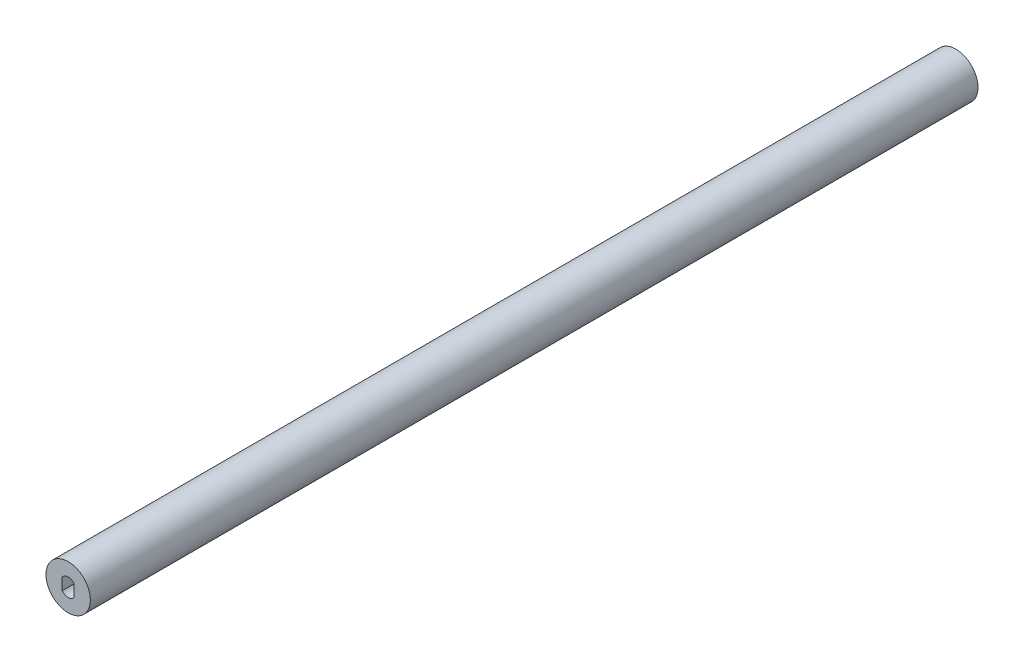
from build123d import *

# Parameters (mm, degrees)
SKETCH1_R           = 7.5
BOSS_EXTRUDE1_DEPTH = 300
CUT_EXTRUDE1_DEPTH  = 5


with BuildPart() as part:
    # Sketch1 → Boss-Extrude1 (new body)
    with BuildSketch(Plane.XY):
        with Locations((-21.928145629, 1.412024527)):
            Circle(SKETCH1_R)
    extrude(amount=BOSS_EXTRUDE1_DEPTH)

    # Sketch2 → Cut-Extrude1 (cut)
    with BuildSketch(Plane.XY.offset(300)):
        with BuildLine():
            Line((-23.928145629, 3.412024527), (-23.928145629, -0.587975473))
            ThreePointArc((-23.928145629, -0.587975473), (-21.928145629, -1.587975473), (-19.928145629, -0.587975473))
            Line((-19.928145629, -0.587975473), (-19.928145629, 3.412024527))
            ThreePointArc((-19.928145629, 3.412024527), (-21.928145629, 4.412024527), (-23.928145629, 3.412024527))
        make_face()
    extrude(amount=-CUT_EXTRUDE1_DEPTH, mode=Mode.SUBTRACT)


solid = part.part
